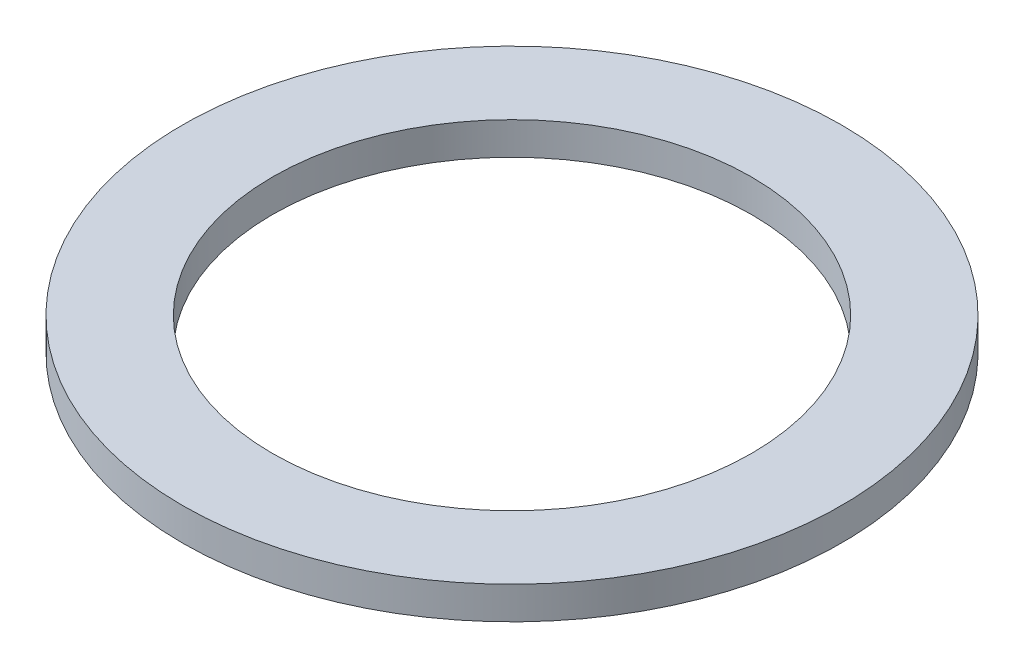
from build123d import *

# Parameters (mm, degrees)
SKETCH1_R           = 8.7376
BOSS_EXTRUDE1_DEPTH = 0.8636
SKETCH5_R           = 6.35
CUT_EXTRUDE1_DEPTH  = 13.3869735


with BuildPart() as part:
    # Sketch1 → Boss-Extrude1 (new body)
    with BuildSketch(Plane(origin=(0, 0, 0), x_dir=(1, 0, 0), z_dir=(0, 1, 0))):
        with Locations(Location((0, 0, 0), (0, 0, 270))):
            Circle(SKETCH1_R)
    extrude(amount=BOSS_EXTRUDE1_DEPTH)

    # Sketch5 → Cut-Extrude1 (cut, through all)
    with BuildSketch(Plane(origin=(0, 0.8636, 0), x_dir=(-1, 0, 0), z_dir=(0, 1, 0))):
        with Locations(Location((0, 0, 0), (0, 0, 90))):
            Circle(SKETCH5_R)
    extrude(amount=-CUT_EXTRUDE1_DEPTH, mode=Mode.SUBTRACT)


solid = part.part
